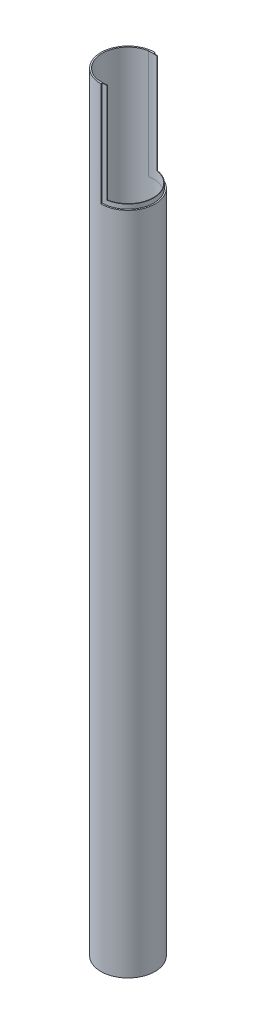
from build123d import *
from build123d.topology import SkipClean

# Parameters (mm, degrees)
SKETCH1_R                = 60
SKETCH1_R_2              = 57
BOSS_EXTRUDE1_DEPTH      = 1700
SKETCH4_R                = 49
BOSS_EXTRUDE2_DEPTH      = 1239
CUT_EXTRUDE1_DEPTH       = 1239
CUT_EXTRUDE1_DEPTH_BACK  = 1239
SKETCH7_W                = 139.911770255
SKETCH7_H                = 230
BOSS_EXTRUDE5_DEPTH      = 10
BOSS_EXTRUDE5_DEPTH_BACK = 10
BOSS_EXTRUDE6_DEPTH      = 220


with BuildPart() as part:
    # Sketch1 → Boss-Extrude1 (new body)
    with BuildSketch(Plane(origin=(0, 0, 0), x_dir=(1, 0, 0), z_dir=(0, 1, 0))):
        Circle(SKETCH1_R)
        Circle(SKETCH1_R_2, mode=Mode.SUBTRACT)
    extrude(amount=BOSS_EXTRUDE1_DEPTH)

    # Sketch7 → Cut-Extrude1 (cut, two sides: drawn at the far end of the back side and taken through both)
    with BuildSketch(Plane.XY.offset(-CUT_EXTRUDE1_DEPTH_BACK)):
        with Locations((69.955885128, 1585)):
            Rectangle(SKETCH7_W, SKETCH7_H)
    extrude(amount=CUT_EXTRUDE1_DEPTH + CUT_EXTRUDE1_DEPTH_BACK, mode=Mode.SUBTRACT)

    # Sketch8 → Boss-Extrude5 (add, two sides: drawn at the far end of the back side and taken through both)
    with BuildSketch(Plane(origin=(0, 1470, 0), x_dir=(1, 0, 0), z_dir=(0, 1, 0)).offset(-BOSS_EXTRUDE5_DEPTH_BACK)):
        with BuildLine():
            Line((-9.724297949, -55.149234169), (-9.897946127, -56.134041922))
            ThreePointArc((-9.897946127, -56.134041922), (57, 0), (-9.897946127, 56.134041922))
            Line((-9.897946127, 56.134041922), (-9.724297949, 55.149234169))
            ThreePointArc((-9.724297949, 55.149234169), (56, 0), (-9.724297949, -55.149234169))
        make_face()
    extrude(amount=BOSS_EXTRUDE5_DEPTH + BOSS_EXTRUDE5_DEPTH_BACK)

    # Sketch9 → Boss-Extrude6 (add)
    with SkipClean():  # the faces are left unmerged after this step: merging them gives an invalid solid
        with BuildSketch(Plane(origin=(0, 1480, 0), x_dir=(1, 0, 0), z_dir=(0, 1, 0))):
            with BuildLine():
                Line((-9.897946127, -56.134041922), (-9.724297949, -55.149234169))
                ThreePointArc((-9.724297949, -55.149234169), (0, -56), (9.724297949, -55.149234169))
                Line((9.724297949, -55.149234169), (9.897946127, -56.134041922))
                ThreePointArc((9.897946127, -56.134041922), (0, -57), (-9.897946127, -56.134041922))
            make_face()
            with BuildLine():
                Line((8.806670499, 56.315562278), (8.652167507, 55.327569958))
                ThreePointArc((8.652167507, 55.327569958), (-0.543430616, 55.99736318), (-9.724297949, 55.149234169))
                Line((-9.724297949, 55.149234169), (-9.897946127, 56.134041922))
                ThreePointArc((-9.897946127, 56.134041922), (-0.553134734, 56.997316094), (8.806670499, 56.315562278))
            make_face()
        extrude(amount=BOSS_EXTRUDE6_DEPTH)


with BuildPart() as body_2:
    # Sketch4 → Boss-Extrude2 (new body)
    with BuildSketch(Plane.XZ):
        Circle(SKETCH4_R)
    extrude(amount=-BOSS_EXTRUDE2_DEPTH)


solid = Compound([part.part, body_2.part])
